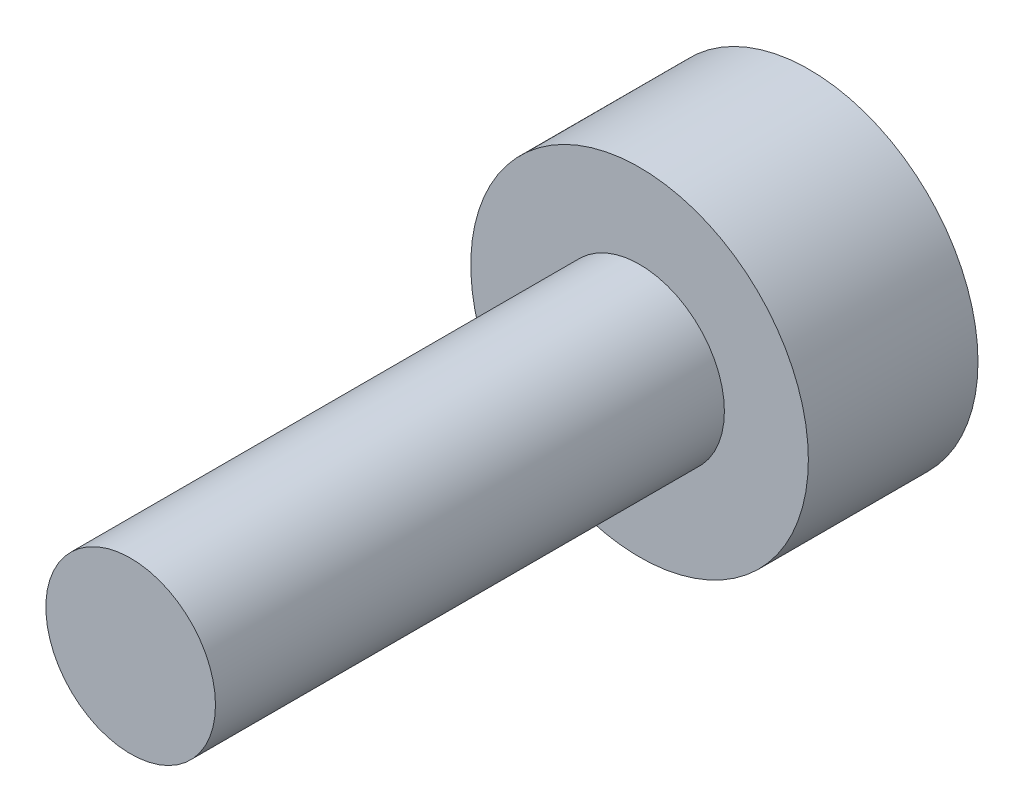
from build123d import *

# Parameters (mm, degrees)
SKETCH_1_R          = 1.99
EXTRUDE_1_DEPTH     = 2
SKETCH_2_R          = 1
EXTRUDE_2_DEPTH     = 6
CUT_EXTRUDE_1_DEPTH = 1


with BuildPart() as part:
    # 草图1 → 凸台-拉伸1 (new body)
    with BuildSketch(Plane.XY):
        Circle(SKETCH_1_R)
    extrude(amount=EXTRUDE_1_DEPTH)

    # 草图2 → 凸台-拉伸2 (add)
    with BuildSketch(Plane.XY.offset(2)):
        Circle(SKETCH_2_R)
    extrude(amount=EXTRUDE_2_DEPTH)

    # 草图3 → 切除-拉伸1 (cut)
    with BuildSketch(Plane(origin=(0, 0, 0), x_dir=(-1, 0, 0), z_dir=(0, 0, -1))):
        Polygon((0.90066642, 0), (0.45033321, 0.78), (-0.45033321, 0.78), (-0.90066642, 0), (-0.45033321, -0.78), (0.45033321, -0.78), align=None)
    extrude(amount=-CUT_EXTRUDE_1_DEPTH, mode=Mode.SUBTRACT)


solid = part.part
